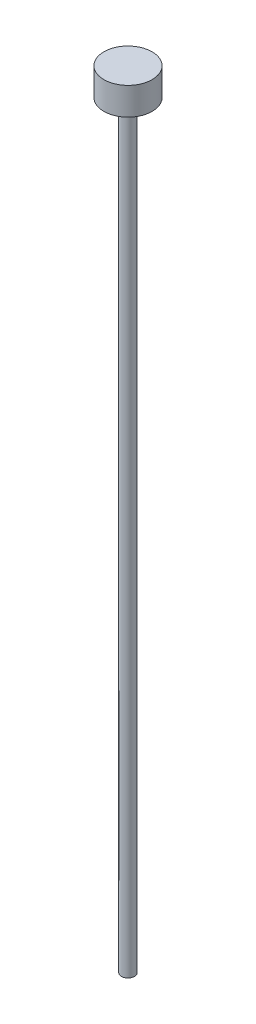
from build123d import *

# Parameters (mm, degrees)
ESBO_O1_R                = 0.95
RESSALTO_EXTRUS_O1_DEPTH = 110
ESBO_O2_R                = 3.5
RESSALTO_EXTRUS_O2_DEPTH = 4
FILETE3_R                = 1


with BuildPart() as part:
    # Esboço1 → Ressalto-extrusão1 (new body)
    with BuildSketch(Plane(origin=(0, 0, 0), x_dir=(1, 0, 0), z_dir=(0, 1, 0))):
        with Locations(Location((0, 0, 0), (0, 0, 270))):
            Circle(ESBO_O1_R)
    extrude(amount=RESSALTO_EXTRUS_O1_DEPTH)

    # Esboço2 → Ressalto-extrusão2 (add)
    with BuildSketch(Plane(origin=(0, 110, 0), x_dir=(1, 0, 0), z_dir=(0, 1, 0))):
        with Locations(Location((0, 0, 0), (0, 0, 270))):
            Circle(ESBO_O2_R)
    extrude(amount=RESSALTO_EXTRUS_O2_DEPTH)

    # Filete3
    filete3_edges = [part.edges().sort_by_distance(p)[0] for p in [
        (0, 110, -0.95),
    ]]
    fillet(filete3_edges, radius=FILETE3_R)


solid = part.part
